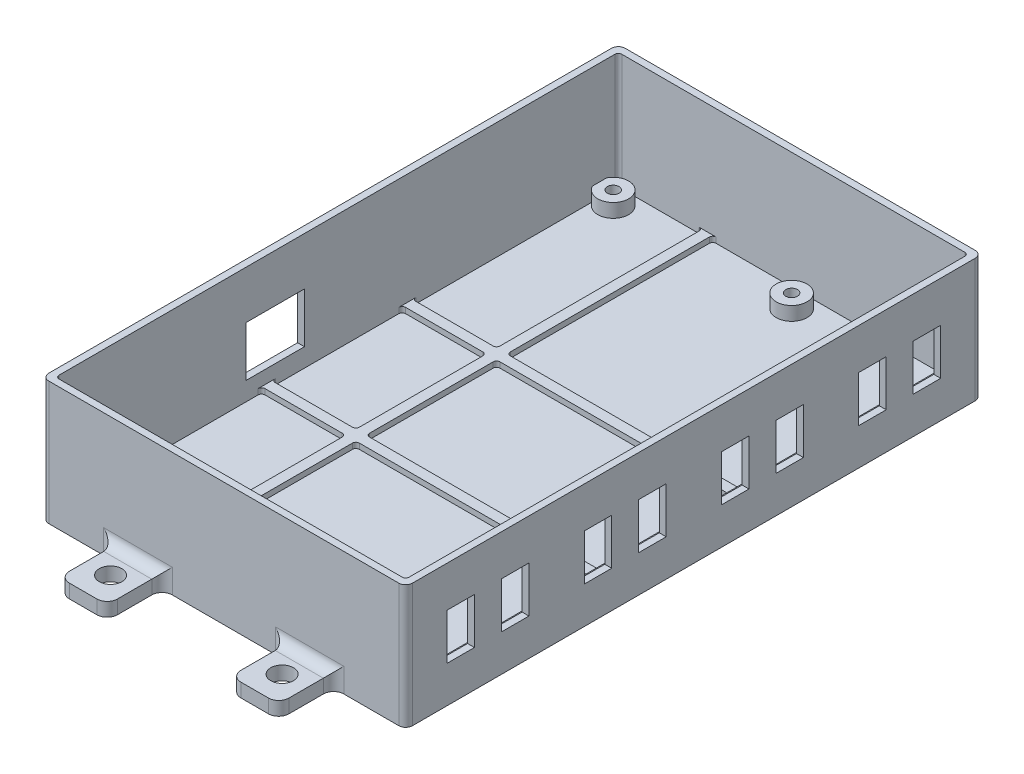
from build123d import *

# Parameters (mm, degrees)
SKIZZE1_W                                    = 106
SKIZZE1_H                                    = 168
AUFSATZ_LINEAR_AUSTRAGEN1_DEPTH              = 36
WANDUNG1_T                                   = -2
SKIZZE2_R                                    = 4.5
AUFSATZ_LINEAR_AUSTRAGEN2_DEPTH              = 4
VERRUNDUNG1_R                                = 2
STIRNSENKUNG_F_R_M3_ZYLINDERSCHRAUBE_2_COUNT = 2
STIRNSENKUNG_F_R_M3_ZYLINDERSCHRAUBE_2_PITCH = 161.595173195
STIRNSENKUNG_F_R_M3_ZYLINDERSCHRAUBE_3_COUNT = 2
STIRNSENKUNG_F_R_M3_ZYLINDERSCHRAUBE_3_PITCH = 153
STIRNSENKUNG_F_R_M3_ZYLINDERSCHRAUBE_4_COUNT = 2
STIRNSENKUNG_F_R_M3_ZYLINDERSCHRAUBE_4_PITCH = 52
SKIZZE7_W                                    = 17
SKIZZE7_H                                    = 14.6
SCHNITT_LINEAR_AUSTRAGEN1_DEPTH              = 10
SKIZZE8_W                                    = 8
SKIZZE8_H                                    = 13.4
SCHNITT_LINEAR_AUSTRAGEN2_DEPTH              = 10
SKIZZE9_W                                    = 5
SKIZZE9_H                                    = 164
AUFSATZ_LINEAR_AUSTRAGEN3_DEPTH              = 4
LINEARES_MUSTER1_COUNT                       = 4
LINEARES_MUSTER1_PITCH                       = 40
SKIZZE10_W                                   = 14
SKIZZE10_H                                   = 16
AUFSATZ_LINEAR_AUSTRAGEN4_DEPTH              = 4
DURCHGANGSLOCH_F_R_M61_D                     = 6.6
VERRUNDUNG2_R                                = 3
SKIZZE13_W                                   = 47
SKIZZE13_H                                   = 38
AUFSATZ_LINEAR_AUSTRAGEN5_DEPTH              = 1.6
VERRUNDUNG3_R                                = 1
VERRUNDUNG4_R                                = 1


with BuildPart() as part:
    # Skizze1 → Aufsatz-Linear austragen1 (new body)
    with BuildSketch(Plane(origin=(0, 0, 0), x_dir=(1, 0, 0), z_dir=(0, 1, 0))):
        with Locations((53, 84)):
            Rectangle(SKIZZE1_W, SKIZZE1_H)
    extrude(amount=AUFSATZ_LINEAR_AUSTRAGEN1_DEPTH)

    # Wandung1
    wandung1_openings = [part.faces().sort_by_distance(p)[0] for p in [
        (53, 36, -84),
    ]]
    offset(amount=WANDUNG1_T, openings=wandung1_openings, kind=Kind.INTERSECTION)

    # Skizze2 → Aufsatz-Linear austragen2 (add)
    with BuildSketch(Plane(origin=(0, 2, 0), x_dir=(1, 0, 0), z_dir=(0, 1, 0))):
        with Locations((6, 7.5)):
            Circle(SKIZZE2_R)
        with Locations((58, 7.5)):
            Circle(SKIZZE2_R)
        with Locations((58, 160.5)):
            Circle(SKIZZE2_R)
        with Locations((6, 160.5)):
            Circle(SKIZZE2_R)
    extrude(amount=AUFSATZ_LINEAR_AUSTRAGEN2_DEPTH)

    # Verrundung1
    verrundung1_edges = [part.edges().sort_by_distance(p)[0] for p in [
        (0, 18, -168),
        (106, 18, -168),
        (106, 18, 0),
        (0, 18, 0),
    ]]
    fillet(verrundung1_edges, radius=VERRUNDUNG1_R)

    # Skizze6 → Stirnsenkung für M3 Zylinderschraube mit Innensechskant1 (revolve, cut)
    with BuildSketch(Plane(origin=(58, 0, -7.5), x_dir=(0, 0, -1), z_dir=(1, 0, 0))):
        Polygon((0, 0), (0, 15.021463052), (1.7, 14), (1.7, 3.4), (3.25, 3.4), (3.25, 0.025), (3.275, 0), align=None)
    stirnsenkung_f_r_m3_zylinderschraube_mit = revolve(axis=Axis((58, -6.35, -7.5), (0, 1, 0)), mode=Mode.SUBTRACT)

    # Stirnsenkung f_r M3 Zylinderschraube 2: Stirnsenkung für M3 Zylinderschraube mit Innensechskant1 ×2
    with Locations(*[Vector(-0.32179178976573125, 0, -0.9468104583491711) * (i * STIRNSENKUNG_F_R_M3_ZYLINDERSCHRAUBE_2_PITCH) for i in range(1, STIRNSENKUNG_F_R_M3_ZYLINDERSCHRAUBE_2_COUNT)]):
        add(stirnsenkung_f_r_m3_zylinderschraube_mit, mode=Mode.SUBTRACT)

    # Stirnsenkung f_r M3 Zylinderschraube 3: Stirnsenkung für M3 Zylinderschraube mit Innensechskant1 ×2
    with Locations(*[(0, 0, -i * STIRNSENKUNG_F_R_M3_ZYLINDERSCHRAUBE_3_PITCH) for i in range(1, STIRNSENKUNG_F_R_M3_ZYLINDERSCHRAUBE_3_COUNT)]):
        add(stirnsenkung_f_r_m3_zylinderschraube_mit, mode=Mode.SUBTRACT)

    # Stirnsenkung f_r M3 Zylinderschraube 4: Stirnsenkung für M3 Zylinderschraube mit Innensechskant1 ×2
    with Locations(*[(-i * STIRNSENKUNG_F_R_M3_ZYLINDERSCHRAUBE_4_PITCH, 0, 0) for i in range(1, STIRNSENKUNG_F_R_M3_ZYLINDERSCHRAUBE_4_COUNT)]):
        add(stirnsenkung_f_r_m3_zylinderschraube_mit, mode=Mode.SUBTRACT)

    # Skizze7 → Schnitt-Linear austragen1 (cut)
    with BuildSketch(Plane.ZY):
        with Locations((-66, 14.72)):
            Rectangle(SKIZZE7_W, SKIZZE7_H)
    extrude(amount=-SCHNITT_LINEAR_AUSTRAGEN1_DEPTH, mode=Mode.SUBTRACT)

    # Skizze8 → Schnitt-Linear austragen2 (cut)
    with BuildSketch(Plane(origin=(106, 0, 0), x_dir=(0, 0, -1), z_dir=(1, 0, 0))):
        with Locations((16.06, 17.42)):
            Rectangle(SKIZZE8_W, SKIZZE8_H)
        with Locations((31.94, 17.42)):
            Rectangle(SKIZZE8_W, SKIZZE8_H)
    schnitt_linear_austragen2 = extrude(amount=-SCHNITT_LINEAR_AUSTRAGEN2_DEPTH, mode=Mode.SUBTRACT)

    # Skizze9 → Aufsatz-Linear austragen3 (add)
    with BuildSketch(Plane(origin=(0, 2, 0), x_dir=(1, 0, 0), z_dir=(0, 1, 0))):
        with Locations((101.5, 84)):
            Rectangle(SKIZZE9_W, SKIZZE9_H)
    extrude(amount=AUFSATZ_LINEAR_AUSTRAGEN3_DEPTH)

    # Lineares Muster1: Schnitt-Linear austragen2 ×4
    with Locations(*[(0, 0, -i * LINEARES_MUSTER1_PITCH) for i in range(1, LINEARES_MUSTER1_COUNT)]):
        add(schnitt_linear_austragen2, mode=Mode.SUBTRACT)

    # Skizze10 → Aufsatz-Linear austragen4 (add)
    with BuildSketch(Plane(origin=(0, 0, 0), x_dir=(1, 0, 0), z_dir=(0, 1, 0))):
        with Locations((78, -8)):
            Rectangle(SKIZZE10_W, SKIZZE10_H)
        with Locations((28, -8)):
            Rectangle(SKIZZE10_W, SKIZZE10_H)
        with Locations((28, 176)):
            Rectangle(SKIZZE10_W, SKIZZE10_H)
        with Locations((78, 176)):
            Rectangle(SKIZZE10_W, SKIZZE10_H)
    extrude(amount=AUFSATZ_LINEAR_AUSTRAGEN4_DEPTH)

    # Durchgangsloch für M61 (through all)
    with Locations(Plane(origin=(0, 4, 0), x_dir=(1, 0, 0), z_dir=(0, 1, 0))):
        with Locations((78, 176), (28, 176), (78, -8), (28, -8)):
            Hole(DURCHGANGSLOCH_F_R_M61_D / 2)

    # Verrundung2
    verrundung2_edges = [part.edges().sort_by_distance(p)[0] for p in [
        (85, 2, 16),
        (71, 2, 16),
        (71, 2, 0),
        (78, 4, 0),
        (85, 2, 0),
        (21, 2, 16),
        (35, 2, 16),
        (35, 2, 0),
        (28, 4, 0),
        (21, 2, 0),
        (35, 2, -184),
        (21, 2, -184),
        (21, 2, -168),
        (28, 4, -168),
        (35, 2, -168),
        (85, 2, -168),
        (78, 4, -168),
        (71, 2, -168),
        (71, 2, -184),
        (85, 2, -184),
    ]]
    fillet(verrundung2_edges, radius=VERRUNDUNG2_R)

    # Skizze13 → Aufsatz-Linear austragen5 (add)
    with BuildSketch(Plane(origin=(0, 2, 0), x_dir=(1, 0, 0), z_dir=(0, 1, 0))):
        Polygon((79.5, 166), (76.5, 166), (76.5, 106), (29.5, 106), (29.5, 166), (26.5, 166), (26.5, 106), (2, 106), (2, 103), (26.5, 103), (26.5, 65), (2, 65), (2, 62), (26.5, 62), (26.5, 2), (29.5, 2), (29.5, 62), (76.5, 62), (76.5, 2), (79.5, 2), (79.5, 62), (99, 62), (99, 65), (79.5, 65), (79.5, 103), (99, 103), (99, 106), (79.5, 106), align=None)
        with Locations((53, 84)):
            Rectangle(SKIZZE13_W, SKIZZE13_H, mode=Mode.SUBTRACT)
    extrude(amount=AUFSATZ_LINEAR_AUSTRAGEN5_DEPTH)

    # Verrundung3
    verrundung3_edges = [part.edges().sort_by_distance(p)[0] for p in [
        (79.5, 2.8, -62),
        (76.5, 2.8, -62),
        (76.5, 2.8, -65),
        (79.5, 2.8, -65),
        (76.5, 2.8, -103),
        (76.5, 2.8, -106),
        (79.5, 2.8, -106),
        (79.5, 2.8, -103),
        (26.5, 2.8, -106),
        (29.5, 2.8, -106),
        (26.5, 2.8, -103),
        (29.5, 2.8, -103),
        (26.5, 2.8, -65),
        (26.5, 2.8, -62),
        (29.5, 2.8, -62),
        (29.5, 2.8, -65),
        (79.5, 2.8, -2),
        (76.5, 2.8, -2),
        (26.5, 2.8, -2),
        (29.5, 2.8, -2),
        (2, 2.8, -62),
        (2, 2.8, -65),
        (2, 2.8, -103),
        (2, 2.8, -106),
        (26.5, 2.8, -166),
        (29.5, 2.8, -166),
        (79.5, 2.8, -166),
        (76.5, 2.8, -166),
        (99, 2.8, -62),
        (99, 2.8, -65),
        (99, 2.8, -103),
        (99, 2.8, -106),
    ]]
    fillet(verrundung3_edges, radius=VERRUNDUNG3_R)

    # Verrundung4
    verrundung4_edges = [part.edges().sort_by_distance(p)[0] for p in [
        (104, 21, -166),
        (2, 19, -166),
        (2, 19, -2),
        (104, 21, -2),
    ]]
    fillet(verrundung4_edges, radius=VERRUNDUNG4_R)


solid = part.part
